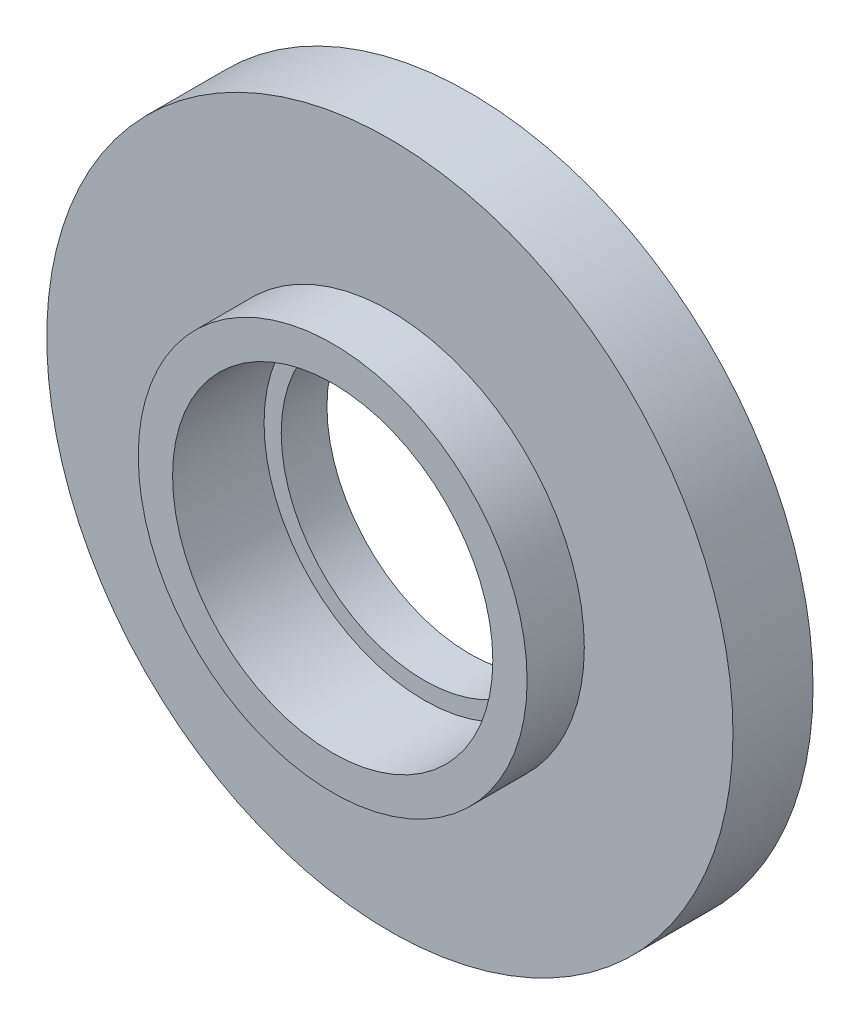
from build123d import *

# Parameters (mm, degrees)
SKETCH4_R          = 14
CUT_EXTRUDE1_DEPTH = 8
SKETCH5_R          = 12.5
CUT_EXTRUDE4_DEPTH = 8.1
SKETCH7_R          = 2.5
CUT_EXTRUDE5_DEPTH = 3


with BuildPart() as part:
    # Sketch2 → Revolve4 (revolve)
    with BuildSketch(Plane(origin=(0, 0, 0), x_dir=(1, 0, 0), z_dir=(0, 1, 0)), mode=Mode.PRIVATE) as revolve4_sk:
        Polygon((0, 0), (-30, 0), (-30, -7), (-17, -7), (-17, -12), (0, -12), align=None)
    revolve(revolve4_sk.sketch.rotate(Axis((0, 0, 12), (0, 0, -1)), 180), axis=Axis((0, 0, 12), (0, 0, -1)))

    # Sketch4 → Cut-Extrude1 (cut)
    with BuildSketch(Plane.XY.offset(12)):
        Circle(SKETCH4_R)
    extrude(amount=-CUT_EXTRUDE1_DEPTH, mode=Mode.SUBTRACT)

    # Sketch5 → Cut-Extrude4 (cut)
    with BuildSketch(Plane(origin=(0, 0, 0), x_dir=(-1, 0, 0), z_dir=(0, 0, -1))):
        Circle(SKETCH5_R)
    extrude(amount=-CUT_EXTRUDE4_DEPTH, mode=Mode.SUBTRACT)

    # Sketch7 → Cut-Extrude5 (cut)
    with BuildSketch(Plane(origin=(0, 0, 0), x_dir=(-1, 0, 0), z_dir=(0, 0, -1))):
        with Locations((0, 18)):
            Circle(SKETCH7_R)
        with Locations((15.588457268, 9)):
            Circle(SKETCH7_R)
        with Locations((15.588457268, -9)):
            Circle(SKETCH7_R)
        with Locations((0, -18)):
            Circle(SKETCH7_R)
        with Locations((-15.588457268, -9)):
            Circle(SKETCH7_R)
        with Locations((-15.588457268, 9)):
            Circle(SKETCH7_R)
    extrude(amount=-CUT_EXTRUDE5_DEPTH, mode=Mode.SUBTRACT)


solid = part.part
